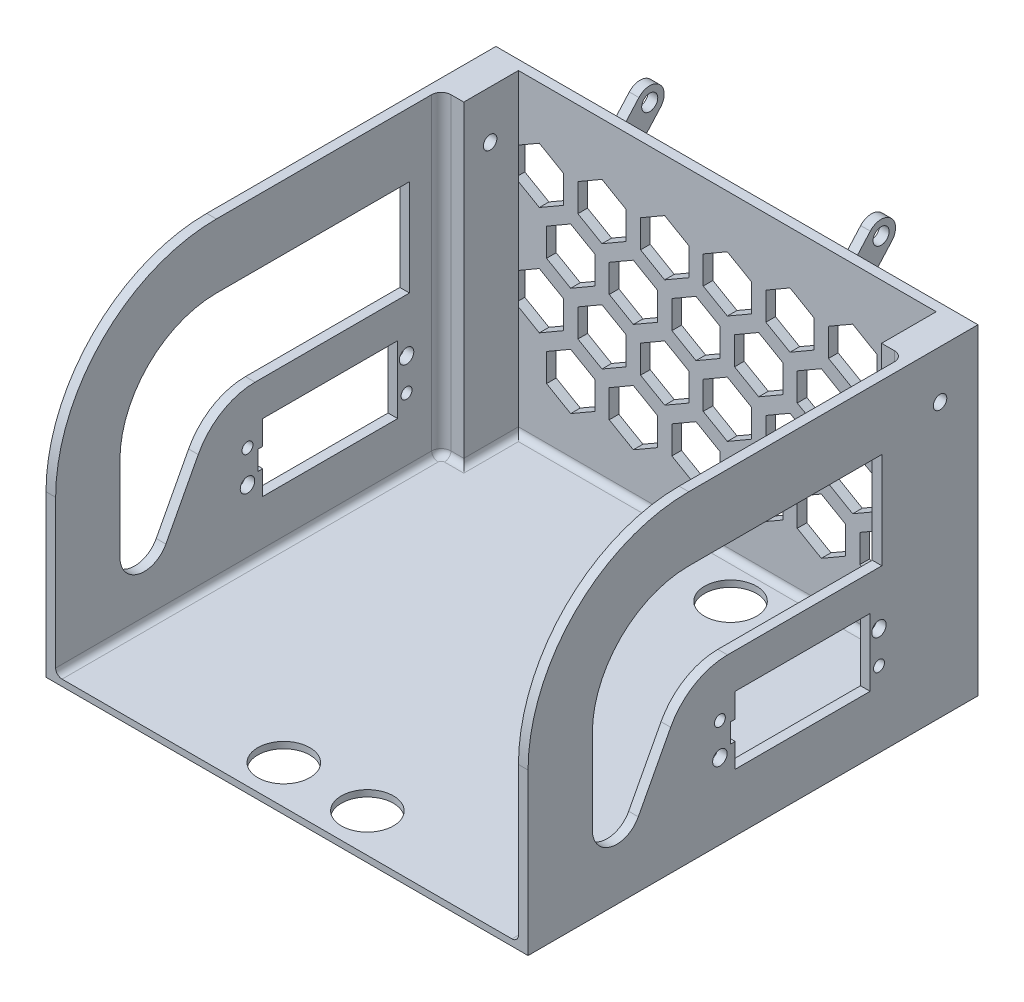
from build123d import *

# Parameters (mm, degrees)
BOSS_EXTRUDE1_DEPTH              = 150
SKETCH2_W                        = 144
SKETCH2_H                        = 142
CUT_EXTRUDE1_DEPTH               = 98
SKETCH1_4_W                      = 20
SKETCH1_4_H                      = 100
SALIENTE_EXTRUIR1_DEPTH          = 10
SKETCH3_R                        = 2.5
BOSS_EXTRUDE2_DEPTH              = 1.5
REDONDEO3_R                      = 3
SKETCH4_R                        = 2.1
SKETCH4_W                        = 42
SKETCH4_H                        = 21
CUT_EXTRUDE2_DEPTH               = 231.936733782
CUT_EXTRUDE3_DEPTH               = 3
TALADRO_DE_MARGEN_PARA_M31_D     = 3.4
TALADRO_DE_MARGEN_PARA_M31_DEPTH = 3
TALADRO_DE_MARGEN_PARA_M41_D     = 4.5
TALADRO_DE_MARGEN_PARA_M41_DEPTH = 3
CORTAR_EXTRUIR1_REACH            = 231
REDONDEO1_R                      = 20
CORTAR_EXTRUIR2_REACH            = 232.937
SKETCH4_4_W                      = 1.4
SKETCH4_4_H                      = 6
REDONDEO4_R                      = 3
REDONDEO1_OF_SIMETR_A2_R         = 20
REDONDEO5_R                      = 2
CORTAR_EXTRUIR3_REACH            = 232.026
CROQUIS8_R                       = 8.1


with BuildPart() as part:
    # Sketch1 → Boss-Extrude1 (new body)
    with BuildSketch(Plane(origin=(0, 0, 0), x_dir=(0, 0, -1), z_dir=(1, 0, 0))):
        with BuildLine():
            Line((0, 0), (-140, 0))
            Line((-140, 0), (-140, 50))
            ThreePointArc((-140, 50), (-125.355339059, 85.355339059), (-90, 100))
            Line((-90, 100), (0, 100))
            Line((0, 100), (0, 0))
        make_face()
    extrude(amount=BOSS_EXTRUDE1_DEPTH)

    # Sketch2 → Cut-Extrude1 (cut)
    with BuildSketch(Plane(origin=(0, 100, 0), x_dir=(1, 0, 0), z_dir=(0, 1, 0))):
        with Locations((75, -74)):
            Rectangle(SKETCH2_W, SKETCH2_H)
    extrude(amount=-CUT_EXTRUDE1_DEPTH, mode=Mode.SUBTRACT)

    # Sketch1<4> → Saliente-Extruir1 (add)
    with BuildSketch(Plane(origin=(0, 0, 0), x_dir=(0, 0, -1), z_dir=(1, 0, 0))):
        with Locations((-10, 50)):
            Rectangle(SKETCH1_4_W, SKETCH1_4_H)
    saliente_extruir1 = extrude(amount=SALIENTE_EXTRUIR1_DEPTH)

    # Sketch3 → Boss-Extrude2 (add, symmetric)
    with BuildSketch(Plane(origin=(111, 0, 0), x_dir=(0, 0, -1), z_dir=(1, 0, 0))):
        with BuildLine():
            Line((0, 100), (0, 86.483689179))
            Line((0, 86.483689179), (10.709846007, 98.483689179))
            ThreePointArc((10.709846007, 98.483689179), (10.348889249, 104.837405432), (3.995172996, 104.476448674))
            Line((3.995172996, 104.476448674), (0, 100))
        make_face()
        with Locations((7.352509502, 101.480068927)):
            Circle(SKETCH3_R, mode=Mode.SUBTRACT)
    boss_extrude2 = extrude(amount=BOSS_EXTRUDE2_DEPTH, both=True)

    # Mirror1: Boss-Extrude2 across plane
    add(boss_extrude2.mirror(Plane(origin=(75, 0, 0), x_dir=(0, 0, 1), z_dir=(1, 0, 0))))

    # Redondeo3
    redondeo3_edges = [part.edges().sort_by_distance(p)[0] for p in [
        (3, 51, 20),
    ]]
    fillet(redondeo3_edges, radius=REDONDEO3_R)

    # Simetría1: Saliente-Extruir1 across plane
    add(saliente_extruir1.mirror(Plane(origin=(75, 0, 0), x_dir=(0, 0, 1), z_dir=(1, 0, 0))))

    # Sketch4 → Cut-Extrude2 (cut, through all)
    with BuildSketch(Plane(origin=(150, 0, 0), x_dir=(0, 0, -1), z_dir=(1, 0, 0))):
        with Locations((-11.810728321, 85.063406284)):
            Circle(SKETCH4_R)
        with Locations((-54.561214212, 28.49486379)):
            Rectangle(SKETCH4_W, SKETCH4_H)
    extrude(amount=-CUT_EXTRUDE2_DEPTH, mode=Mode.SUBTRACT)

    # Sketch5 → Cut-Extrude3 (cut)
    with BuildSketch(Plane(origin=(0, 0, 0), x_dir=(-1, 0, 0), z_dir=(0, 0, -1))):
        Polygon((-114, 83.660254038), (-121.5, 79.330127019), (-121.5, 70.669872981), (-114, 66.339745962), (-106.5, 70.669872981), (-106.5, 79.330127019), align=None)
        Polygon((-133.5, 83.660254038), (-141, 79.330127019), (-141, 70.669872981), (-133.5, 66.339745962), (-126, 70.669872981), (-126, 79.330127019), align=None)
        Polygon((-94.5, 83.660254038), (-102, 79.330127019), (-102, 70.669872981), (-94.5, 66.339745962), (-87, 70.669872981), (-87, 79.330127019), align=None)
        Polygon((-75, 83.660254038), (-82.5, 79.330127019), (-82.5, 70.669872981), (-75, 66.339745962), (-67.5, 70.669872981), (-67.5, 79.330127019), align=None)
        Polygon((-55.5, 83.660254038), (-63, 79.330127019), (-63, 70.669872981), (-55.5, 66.339745962), (-48, 70.669872981), (-48, 79.330127019), align=None)
        Polygon((-36, 83.660254038), (-43.5, 79.330127019), (-43.5, 70.669872981), (-36, 66.339745962), (-28.5, 70.669872981), (-28.5, 79.330127019), align=None)
        Polygon((-16.5, 83.660254038), (-24, 79.330127019), (-24, 70.669872981), (-16.5, 66.339745962), (-9, 70.669872981), (-9, 79.330127019), align=None)
        Polygon((-123.75, 66.772758664), (-131.25, 62.442631645), (-131.25, 53.782377607), (-123.75, 49.452250588), (-116.25, 53.782377607), (-116.25, 62.442631645), align=None)
        Polygon((-104.25, 66.772758664), (-111.75, 62.442631645), (-111.75, 53.782377607), (-104.25, 49.452250588), (-96.75, 53.782377607), (-96.75, 62.442631645), align=None)
        Polygon((-84.75, 66.772758664), (-92.25, 62.442631645), (-92.25, 53.782377607), (-84.75, 49.452250588), (-77.25, 53.782377607), (-77.25, 62.442631645), align=None)
        Polygon((-65.25, 66.772758664), (-72.75, 62.442631645), (-72.75, 53.782377607), (-65.25, 49.452250588), (-57.75, 53.782377607), (-57.75, 62.442631645), align=None)
        Polygon((-45.75, 66.772758664), (-53.25, 62.442631645), (-53.25, 53.782377607), (-45.75, 49.452250588), (-38.25, 53.782377607), (-38.25, 62.442631645), align=None)
        Polygon((-26.25, 66.772758664), (-33.75, 62.442631645), (-33.75, 53.782377607), (-26.25, 49.452250588), (-18.75, 53.782377607), (-18.75, 62.442631645), align=None)
        Polygon((-9, 36.894882233), (-16.5, 32.564755215), (-24, 36.894882233), (-24, 45.555136271), (-16.5, 49.88526329), (-9, 45.555136271), align=None)
        Polygon((-28.5, 36.894882233), (-36, 32.564755215), (-43.5, 36.894882233), (-43.5, 45.555136271), (-36, 49.88526329), (-28.5, 45.555136271), align=None)
        Polygon((-48, 36.894882233), (-55.5, 32.564755215), (-63, 36.894882233), (-63, 45.555136271), (-55.5, 49.88526329), (-48, 45.555136271), align=None)
        Polygon((-67.5, 36.894882233), (-75, 32.564755215), (-82.5, 36.894882233), (-82.5, 45.555136271), (-75, 49.88526329), (-67.5, 45.555136271), align=None)
        Polygon((-87, 36.894882233), (-94.5, 32.564755215), (-102, 36.894882233), (-102, 45.555136271), (-94.5, 49.88526329), (-87, 45.555136271), align=None)
        Polygon((-106.5, 36.894882233), (-114, 32.564755215), (-121.5, 36.894882233), (-121.5, 45.555136271), (-114, 49.88526329), (-106.5, 45.555136271), align=None)
        Polygon((-126, 36.894882233), (-133.5, 32.564755215), (-141, 36.894882233), (-141, 45.555136271), (-133.5, 49.88526329), (-126, 45.555136271), align=None)
        Polygon((-18.75, 20.00738686), (-26.25, 15.677259841), (-33.75, 20.00738686), (-33.75, 28.667640898), (-26.25, 32.997767916), (-18.75, 28.667640898), align=None)
        Polygon((-38.25, 20.00738686), (-45.75, 15.677259841), (-53.25, 20.00738686), (-53.25, 28.667640898), (-45.75, 32.997767916), (-38.25, 28.667640898), align=None)
        Polygon((-57.75, 20.00738686), (-65.25, 15.677259841), (-72.75, 20.00738686), (-72.75, 28.667640898), (-65.25, 32.997767916), (-57.75, 28.667640898), align=None)
        Polygon((-77.25, 20.00738686), (-84.75, 15.677259841), (-92.25, 20.00738686), (-92.25, 28.667640898), (-84.75, 32.997767916), (-77.25, 28.667640898), align=None)
        Polygon((-96.75, 20.00738686), (-104.25, 15.677259841), (-111.75, 20.00738686), (-111.75, 28.667640898), (-104.25, 32.997767916), (-96.75, 28.667640898), align=None)
        Polygon((-116.25, 20.00738686), (-123.75, 15.677259841), (-131.25, 20.00738686), (-131.25, 28.667640898), (-123.75, 32.997767916), (-116.25, 28.667640898), align=None)
    extrude(amount=-CUT_EXTRUDE3_DEPTH, mode=Mode.SUBTRACT)

    # Taladro de margen para M31
    with Locations(Plane(origin=(150, 0, 0), x_dir=(0, 0, -1), z_dir=(1, 0, 0))):
        with Locations((-80.311214212, 33.49486379), (-30.811214212, 23.49486379)):
            taladro_de_margen_para_m31 = Hole(TALADRO_DE_MARGEN_PARA_M31_D / 2, depth=TALADRO_DE_MARGEN_PARA_M31_DEPTH)

    # Taladro de margen para M41
    with Locations(Plane(origin=(150, 0, 0), x_dir=(0, 0, -1), z_dir=(1, 0, 0))):
        with Locations((-80.311214212, 23.49486379), (-30.811214212, 33.49486379)):
            taladro_de_margen_para_m41 = Hole(TALADRO_DE_MARGEN_PARA_M41_D / 2, depth=TALADRO_DE_MARGEN_PARA_M41_DEPTH)

    # Croquis5 → Cortar-Extruir1 (cut, up to next)
    with BuildSketch(Plane.ZY.offset(-147), mode=Mode.PRIVATE) as cortar_extruir1_sk1:
        with BuildLine():
            Line((120, 50), (120, 23.786469398))
            ThreePointArc((120, 23.786469398), (114.235115541, 16.419925341), (105.698855292, 20.245121433))
            Line((105.698855292, 20.245121433), (90, 50))
            Line((90, 50), (29.908417384, 50))
            Line((29.908417384, 50), (29.908417384, 80))
            Line((29.908417384, 80), (90, 80))
            ThreePointArc((90, 80), (111.213203436, 71.213203436), (120, 50))
        make_face()
    cortar_extruir1_tool1 = extrude(cortar_extruir1_sk1.sketch, amount=-CORTAR_EXTRUIR1_REACH, mode=Mode.PRIVATE) & part.part
    cortar_extruir1 = cortar_extruir1_tool1.solids().sort_by_distance((147, 58.173, 79.970314))[0]
    add(cortar_extruir1, mode=Mode.SUBTRACT)

    # Redondeo1
    redondeo1_edges = [part.edges().sort_by_distance(p)[0] for p in [
        (148.5, 50, 90),
    ]]
    fillet(redondeo1_edges, radius=REDONDEO1_R)

    # Sketch4<4> → Cortar-Extruir2 (cut, up to next)
    with BuildSketch(Plane(origin=(150, 0, 0), x_dir=(0, 0, -1), z_dir=(1, 0, 0)), mode=Mode.PRIVATE) as cortar_extruir2_sk1:
        with Locations((-76.261214212, 28.49486379)):
            Rectangle(SKETCH4_4_W, SKETCH4_4_H)
    cortar_extruir2_tool1 = extrude(cortar_extruir2_sk1.sketch, amount=-CORTAR_EXTRUIR2_REACH, mode=Mode.PRIVATE) & part.part
    cortar_extruir2 = cortar_extruir2_tool1.solids().sort_by_distance((150, 28.494864, 76.261214))[0]
    add(cortar_extruir2, mode=Mode.SUBTRACT)

    # Redondeo4
    redondeo4_edges = [part.edges().sort_by_distance(p)[0] for p in [
        (147, 51, 20),
    ]]
    fillet(redondeo4_edges, radius=REDONDEO4_R)

    # Simetría2: Taladro de margen para M31, Taladro de margen para M41, Cortar-Extruir1, Cortar-Extruir2 across plane
    add(taladro_de_margen_para_m31.mirror(Plane(origin=(75, 0, 0), x_dir=(0, 0, 1), z_dir=(1, 0, 0))), mode=Mode.SUBTRACT)
    add(taladro_de_margen_para_m41.mirror(Plane(origin=(75, 0, 0), x_dir=(0, 0, 1), z_dir=(1, 0, 0))), mode=Mode.SUBTRACT)
    add(cortar_extruir1.mirror(Plane(origin=(75, 0, 0), x_dir=(0, 0, 1), z_dir=(1, 0, 0))), mode=Mode.SUBTRACT)
    add(cortar_extruir2.mirror(Plane(origin=(75, 0, 0), x_dir=(0, 0, 1), z_dir=(1, 0, 0))), mode=Mode.SUBTRACT)

    # Redondeo1 of Simetría2
    redondeo1_of_simetr_a2_edges = [part.edges().sort_by_distance(p)[0] for p in [
        (1.5, 50, 90),
    ]]
    fillet(redondeo1_of_simetr_a2_edges, radius=REDONDEO1_OF_SIMETR_A2_R)

    # Redondeo5
    redondeo5_edges = [part.edges().sort_by_distance(p)[0] for p in [
        (75, 2, 3),
        (140, 2, 11.5),
        (147, 2, 81.5),
        (10, 2, 11.5),
        (142, 2, 20),
        (146.121320344, 2, 20.878679656),
        (8, 2, 20),
        (3, 2, 81.5),
        (3.878679656, 2, 20.878679656),
    ]]
    fillet(redondeo5_edges, radius=REDONDEO5_R)

    # Croquis8 → Cortar-Extruir3 (cut, up to next)
    with BuildSketch(Plane(origin=(0, 2, 0), x_dir=(1, 0, 0), z_dir=(0, 1, 0)), mode=Mode.PRIVATE) as cortar_extruir3_sk1:
        with Locations(Location((88, -128, 0), (0, 0, 270))):
            Circle(CROQUIS8_R)
    cortar_extruir3_tool1 = extrude(cortar_extruir3_sk1.sketch, amount=-CORTAR_EXTRUIR3_REACH, mode=Mode.PRIVATE) & part.part
    # Croquis8 → Cortar-Extruir3 (cut, up to next)
    with BuildSketch(Plane(origin=(0, 2, 0), x_dir=(1, 0, 0), z_dir=(0, 1, 0)), mode=Mode.PRIVATE) as cortar_extruir3_sk2:
        with Locations(Location((62, -128, 0), (0, 0, 90))):
            Circle(CROQUIS8_R)
    cortar_extruir3_tool2 = extrude(cortar_extruir3_sk2.sketch, amount=-CORTAR_EXTRUIR3_REACH, mode=Mode.PRIVATE) & part.part
    # Croquis8 → Cortar-Extruir3 (cut, up to next)
    with BuildSketch(Plane(origin=(0, 2, 0), x_dir=(1, 0, 0), z_dir=(0, 1, 0)), mode=Mode.PRIVATE) as cortar_extruir3_sk3:
        with Locations(Location((88, -15, 0), (0, 0, 270))):
            Circle(CROQUIS8_R)
    cortar_extruir3_tool3 = extrude(cortar_extruir3_sk3.sketch, amount=-CORTAR_EXTRUIR3_REACH, mode=Mode.PRIVATE) & part.part
    # Croquis8 → Cortar-Extruir3 (cut, up to next)
    with BuildSketch(Plane(origin=(0, 2, 0), x_dir=(1, 0, 0), z_dir=(0, 1, 0)), mode=Mode.PRIVATE) as cortar_extruir3_sk4:
        with Locations(Location((62, -15, 0), (0, 0, 90))):
            Circle(CROQUIS8_R)
    cortar_extruir3_tool4 = extrude(cortar_extruir3_sk4.sketch, amount=-CORTAR_EXTRUIR3_REACH, mode=Mode.PRIVATE) & part.part
    add(cortar_extruir3_tool1.solids().sort_by_distance((88, 2, 128))[0], mode=Mode.SUBTRACT)
    add(cortar_extruir3_tool2.solids().sort_by_distance((62, 2, 128))[0], mode=Mode.SUBTRACT)
    add(cortar_extruir3_tool3.solids().sort_by_distance((88, 2, 15))[0], mode=Mode.SUBTRACT)
    add(cortar_extruir3_tool4.solids().sort_by_distance((62, 2, 15))[0], mode=Mode.SUBTRACT)


solid = part.part
